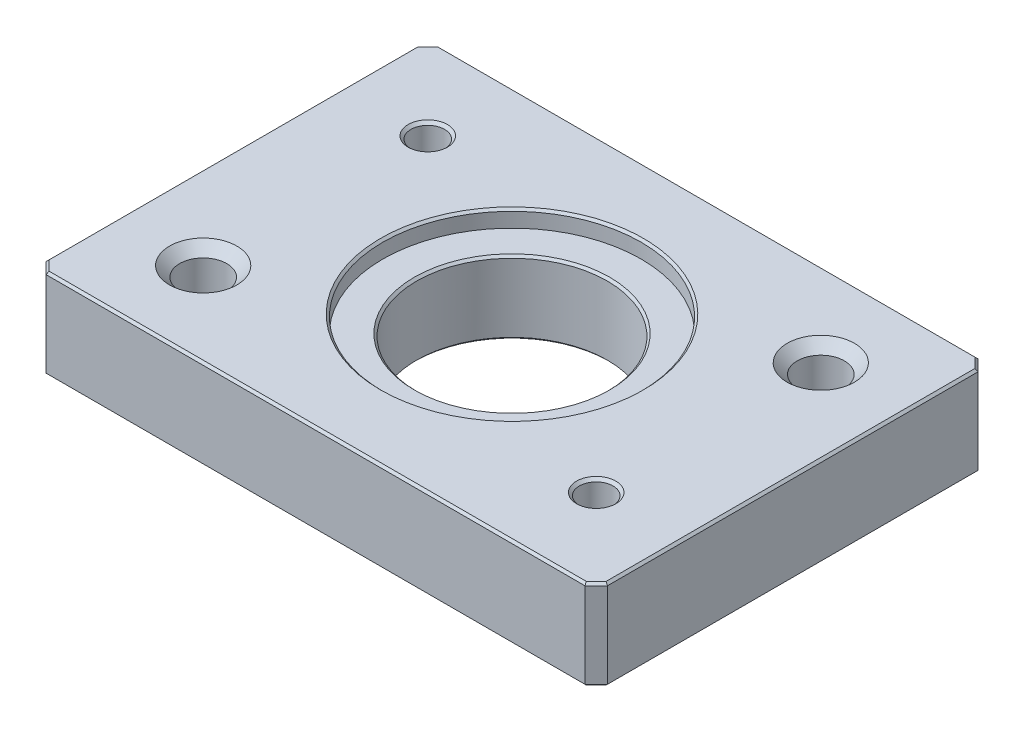
from build123d import *

# Parameters (mm, degrees)
SKETCH1_W                      = 50
SKETCH1_H                      = 35
SKETCH1_R                      = 8.5
BOSS_EXTRUDE1_DEPTH            = 8
F_3_0MM_DOWEL_HOLE1_AT_2_COUNT = 2
F_3_0MM_DOWEL_HOLE1_AT_2_PITCH = 40.311288741
M5X0_8_TAPPED_HOLE1_AT_2_COUNT = 2
M5X0_8_TAPPED_HOLE1_AT_2_PITCH = 40.311288741
SKETCH6_R                      = 11.5
CUT_EXTRUDE1_DEPTH             = 1.5
CHAMFER1_SIZE                  = 1
CHAMFER2_SIZE                  = 0.2


with BuildPart() as part:
    # Sketch1 → Boss-Extrude1 (new body)
    with BuildSketch(Plane(origin=(0, 0, 0), x_dir=(1, 0, 0), z_dir=(0, 1, 0))):
        Rectangle(SKETCH1_W, SKETCH1_H)
        with Locations(Location((0, 0, 0), (0, 0, 270))):
            Circle(SKETCH1_R, mode=Mode.SUBTRACT)
    extrude(amount=BOSS_EXTRUDE1_DEPTH)

    # Sketch3 → Ø3.0mm Dowel Hole1 (revolve, cut)
    with BuildSketch(Plane(origin=(-17.5, 8, -10), x_dir=(0, 0, 1), z_dir=(1, 0, 0))):
        Polygon((0, 0), (0, 8), (1.75, 8), (1.5, 7.75), (1.5, 0.25), (1.75, 0), align=None)
    f_3_0mm_dowel_hole1 = revolve(axis=Axis((-17.5, 14.35, -10), (0, -1, 0)), mode=Mode.SUBTRACT)

    # Ø3.0mm Dowel Hole1 at 2: Ø3.0mm Dowel Hole1 ×2
    with Locations(*[Vector(0.8682431421244593, 0, 0.49613893835683387) * (i * F_3_0MM_DOWEL_HOLE1_AT_2_PITCH) for i in range(1, F_3_0MM_DOWEL_HOLE1_AT_2_COUNT)]):
        add(f_3_0mm_dowel_hole1, mode=Mode.SUBTRACT)

    # Sketch5 → M5x0.8 Tapped Hole1 (revolve, cut)
    with BuildSketch(Plane(origin=(17.5, 8, -10), x_dir=(0, 0, 1), z_dir=(1, 0, 0))):
        Polygon((0, 0), (0, 8), (3, 8), (2.1, 7.1), (2.1, 0.9), (3, 0), align=None)
    m5x0_8_tapped_hole1 = revolve(axis=Axis((17.5, 14.35, -10), (0, -1, 0)), mode=Mode.SUBTRACT)

    # M5x0.8 Tapped Hole1 at 2: M5x0.8 Tapped Hole1 ×2
    with Locations(*[Vector(-0.8682431421244593, 0, 0.49613893835683387) * (i * M5X0_8_TAPPED_HOLE1_AT_2_PITCH) for i in range(1, M5X0_8_TAPPED_HOLE1_AT_2_COUNT)]):
        add(m5x0_8_tapped_hole1, mode=Mode.SUBTRACT)

    # Sketch6 → Cut-Extrude1 (cut)
    with BuildSketch(Plane(origin=(0, 8, 0), x_dir=(1, 0, 0), z_dir=(0, 1, 0))):
        with Locations(Location((0, 0, 0), (0, 0, 270))):
            Circle(SKETCH6_R)
    extrude(amount=-CUT_EXTRUDE1_DEPTH, mode=Mode.SUBTRACT)

    # Chamfer1
    chamfer1_edges = [part.edges().sort_by_distance(p)[0] for p in [
        (-25, 4, -17.5),
        (25, 4, -17.5),
        (25, 4, 17.5),
        (-25, 4, 17.5),
    ]]
    chamfer(chamfer1_edges, length=CHAMFER1_SIZE)

    # Chamfer2
    chamfer2_edges = [part.edges().sort_by_distance(p)[0] for p in [
        (0, 0, -8.5),
        (0, 6.5, -8.5),
        (0, 8, -11.5),
        (0, 0, -17.5),
        (0, 8, -17.5),
        (-25, 0, 0),
        (25, 0, 0),
        (0, 0, 17.5),
        (-24.5, 0, 17),
        (-24.5, 0, -17),
        (24.5, 0, 17),
        (24.5, 0, -17),
        (25, 8, 0),
        (-25, 8, 0),
        (0, 8, 17.5),
        (-24.5, 8, 17),
        (-24.5, 8, -17),
        (24.5, 8, 17),
        (24.5, 8, -17),
    ]]
    chamfer(chamfer2_edges, length=CHAMFER2_SIZE)


solid = part.part
